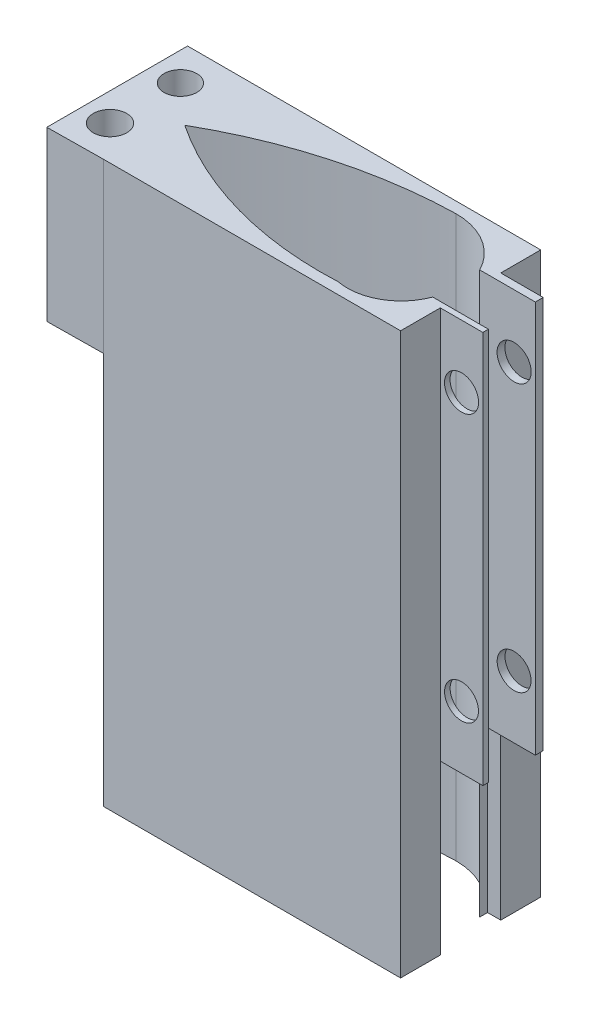
from build123d import *

# Parameters (mm, degrees)
SKETCH1_W           = 67.320921889
SKETCH1_H           = 31.744824956
BOSS_EXTRUDE1_DEPTH = 127
BOSS_EXTRUDE2_DEPTH = 38.1
SKETCH3_R           = 3.798675559
CUT_EXTRUDE1_DEPTH  = 53.34
SKETCH4_R           = 3.713025355
CUT_EXTRUDE2_DEPTH  = 72.898
CUT_EXTRUDE3_DEPTH  = 177.8
CUT_EXTRUDE4_DEPTH  = 140.752657
SKETCH7_W           = 12.598265338
SKETCH7_H           = 1.777860749
BOSS_EXTRUDE3_DEPTH = 88.936657
SKETCH8_W           = 12.621827424
SKETCH8_H           = 1.259783395
BOSS_EXTRUDE4_DEPTH = 88.936657
SKETCH9_R           = 3.862443539
CUT_EXTRUDE5_DEPTH  = 31.278657
SKETCH10_R          = 3.842033399
CUT_EXTRUDE6_DEPTH  = 32.548657


with BuildPart() as part:
    # Sketch1 → Boss-Extrude1 (new body)
    with BuildSketch(Plane(origin=(0, 0, 0), x_dir=(1, 0, 0), z_dir=(0, 1, 0))):
        with Locations((33.660460945, -15.872412478)):
            Rectangle(SKETCH1_W, SKETCH1_H)
    extrude(amount=BOSS_EXTRUDE1_DEPTH)

    # Sketch2 → Boss-Extrude2 (add)
    with BuildSketch(Plane(origin=(0, 127, 0), x_dir=(1, 0, 0), z_dir=(0, 1, 0))):
        Polygon((0, 0), (-12.691812955, 0), (-12.691812955, -31.893008725), (0, -31.744824956), align=None)
    extrude(amount=-BOSS_EXTRUDE2_DEPTH)

    # Sketch3 → Cut-Extrude1 (cut)
    with BuildSketch(Plane(origin=(0, 127, 0), x_dir=(1, 0, 0), z_dir=(0, 1, 0))):
        with Locations(Location((-6.345906477, -23.919756544, 0), (0, 0, 270))):
            Circle(SKETCH3_R)
    extrude(amount=-CUT_EXTRUDE1_DEPTH, mode=Mode.SUBTRACT)

    # Sketch4 → Cut-Extrude2 (cut)
    with BuildSketch(Plane(origin=(0, 127, 0), x_dir=(1, 0, 0), z_dir=(0, 1, 0))):
        with Locations(Location((-6.238928802, -8.074927798, 0), (0, 0, 270))):
            Circle(SKETCH4_R)
    extrude(amount=-CUT_EXTRUDE2_DEPTH, mode=Mode.SUBTRACT)

    # Sketch5 → Cut-Extrude3 (cut)
    with BuildSketch(Plane(origin=(0, 127, 0), x_dir=(1, 0, 0), z_dir=(0, 1, 0))):
        with BuildLine():
            ThreePointArc((64.884408785, -12.014730435), (65.337632333, -15.775676375), (64.884408785, -19.536622316))
            ThreePointArc((64.884408785, -19.536622316), (59.764565977, -27.313148833), (50.645455775, -29.191707899))
            ThreePointArc((50.645455775, -29.191707899), (25.520797189, -26.413912497), (2.545998088, -15.872412478))
            ThreePointArc((2.545998088, -15.872412478), (25.757322084, -6.167748294), (50.645455775, -2.489858962))
            ThreePointArc((50.645455775, -2.489858962), (59.21392875, -5.086156005), (64.884408785, -12.014730435))
        make_face()
    extrude(amount=-CUT_EXTRUDE3_DEPTH, mode=Mode.SUBTRACT)

    # Sketch6 → Cut-Extrude4 (cut)
    with BuildSketch(Plane(origin=(0, 127, 0), x_dir=(1, 0, 0), z_dir=(0, 1, 0))):
        Polygon((64.338150371, -15.872412478), (64.338150371, -22.747923603), (67.320921889, -22.747923603), (67.320921889, -9.054734185), (64.338150371, -9.054734185), align=None)
    extrude(amount=-CUT_EXTRUDE4_DEPTH, mode=Mode.SUBTRACT)

    # Sketch7 → Boss-Extrude3 (add)
    with BuildSketch(Plane(origin=(0, 127, 0), x_dir=(1, 0, 0), z_dir=(0, 1, 0))):
        with Locations((70.63728304, -9.94366456)):
            Rectangle(SKETCH7_W, SKETCH7_H)
    extrude(amount=-BOSS_EXTRUDE3_DEPTH)

    # Sketch8 → Boss-Extrude4 (add)
    with BuildSketch(Plane(origin=(0, 127, 0), x_dir=(1, 0, 0), z_dir=(0, 1, 0))):
        with Locations((70.649064083, -22.118031906)):
            Rectangle(SKETCH8_W, SKETCH8_H)
    extrude(amount=-BOSS_EXTRUDE4_DEPTH)

    # Sketch9 → Cut-Extrude5 (cut)
    with BuildSketch(Plane(origin=(0, 0, 9.054734185), x_dir=(-1, 0, 0), z_dir=(0, 0, -1))):
        with Locations((-72.128668799, 112.805210201)):
            Circle(SKETCH9_R)
    extrude(amount=-CUT_EXTRUDE5_DEPTH, mode=Mode.SUBTRACT)

    # Sketch10 → Cut-Extrude6 (cut)
    with BuildSketch(Plane(origin=(0, 0, 9.054734185), x_dir=(-1, 0, 0), z_dir=(0, 0, -1))):
        with Locations((-72.128668799, 52.198950376)):
            Circle(SKETCH10_R)
    extrude(amount=-CUT_EXTRUDE6_DEPTH, mode=Mode.SUBTRACT)


solid = part.part
